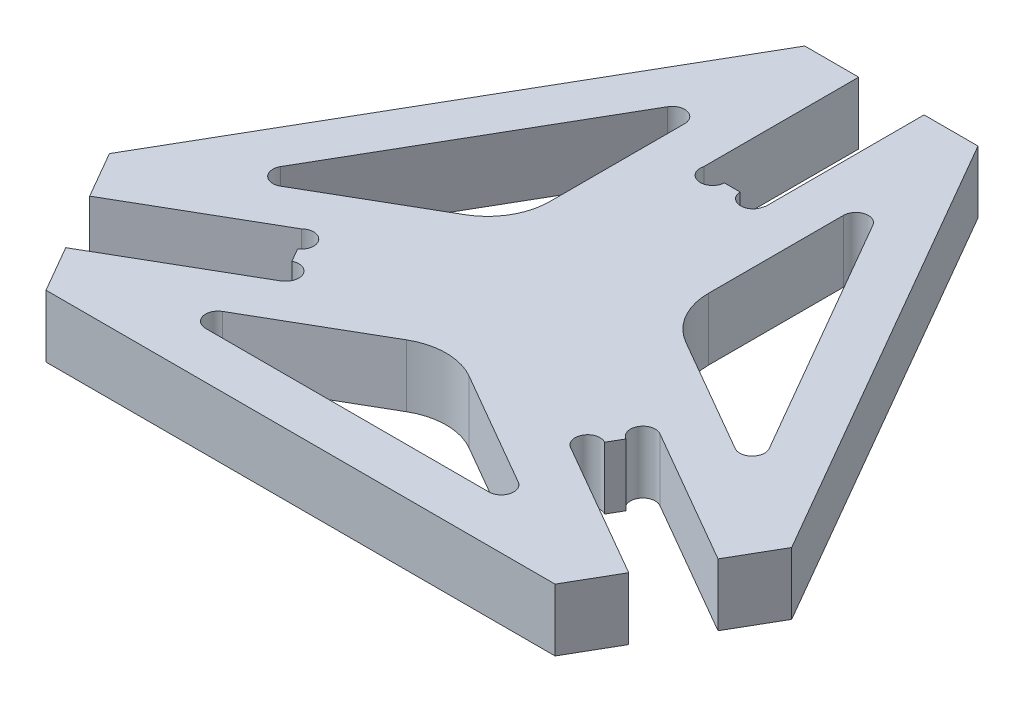
from build123d import *

# Parameters (mm, degrees)
EXTRUDE_1_DEPTH          = 1
CUT_EXTRUDE_1_DEPTH      = 5
SKETCH_4_R               = 0.4
CUT_EXTRUDE_2_DEPTH      = 5
PATTERN_CIRCULAR_3_COUNT = 3
FILLET_1_R               = 0.4
FILLET_2_R               = 2


with BuildPart() as part:
    # 草图1 → 凸台-拉伸1 (new, symmetric)
    with BuildSketch(Plane(origin=(0, 0, 0), x_dir=(1, 0, 0), z_dir=(0, 1, 0))):
        Polygon((9.041729559, -19.298041681), (-9.041729559, -19.298041681), (-8.175704156, -20.798041681), (8.175704156, -20.798041681), align=None)
        Polygon((2.782050808, -1.818653348), (1.05, -1.818653348), (10.091729559, -17.479388333), (10.957754963, -15.979388333), align=None)
        Polygon((-10.091729559, -17.479388333), (-1.05, -1.818653348), (-2.782050808, -1.818653348), (-10.957754963, -15.979388333), align=None)
        Polygon((-1.05, -6.918653348), (-1.05, -1.818653348), (-10.091729559, -17.479388333), (-5.675, -14.929388333), (-4.625, -16.748041681), (-9.041729559, -19.298041681), (9.041729559, -19.298041681), (4.625, -16.748041681), (5.675, -14.929388333), (10.091729559, -17.479388333), (1.05, -1.818653348), (1.05, -6.918653348), align=None)
    extrude(amount=EXTRUDE_1_DEPTH, both=True)

    # 草图2 → 切除-拉伸1 (cut, symmetric)
    with BuildSketch(Plane(origin=(0, 1, 0), x_dir=(1, 0, 0), z_dir=(0, 1, 0))):
        Polygon((8.591729559, -14.881312122), (2.55, -4.416729559), (2.55, -11.393117934), align=None)
        Polygon((6.041729559, -19.298041681), (0, -15.809847493), (-6.041729559, -19.298041681), align=None)
        Polygon((-2.55, -11.393117934), (-2.55, -4.416729559), (-8.591729559, -14.881312122), align=None)
    extrude(amount=CUT_EXTRUDE_1_DEPTH, both=True, mode=Mode.SUBTRACT)

    # 草图4 → 切除-拉伸2 (cut, symmetric)
    with BuildSketch(Plane(origin=(0, 1, 0), x_dir=(1, 0, 0), z_dir=(0, 1, 0))):
        with Locations((5.475, -15.275798494)):
            Circle(SKETCH_4_R)
        with Locations((4.825, -16.401631519)):
            Circle(SKETCH_4_R)
    cut_extrude_2 = extrude(amount=CUT_EXTRUDE_2_DEPTH, both=True, mode=Mode.SUBTRACT)

    # 阵列(圆周)3: 切除-拉伸2 ×3 about axis
    pattern_circular_3_axis = Axis((-0.013172797, 0, 12.857755803), (0, 1, 0))
    for i in range(1, PATTERN_CIRCULAR_3_COUNT):
        add(cut_extrude_2.rotate(pattern_circular_3_axis, i * 360 / PATTERN_CIRCULAR_3_COUNT), mode=Mode.SUBTRACT)

    # 圆角1
    fillet_1_edges = [part.edges().sort_by_distance(p)[0] for p in [
        (-2.55, 0, 4.416729559),
        (-8.591729559, 0, 14.881312122),
        (-6.041729559, 0, 19.298041681),
        (6.041729559, 0, 19.298041681),
        (8.591729559, 0, 14.881312122),
        (2.55, 0, 4.416729559),
    ]]
    fillet(fillet_1_edges, radius=FILLET_1_R)

    # 圆角2
    fillet_2_edges = [part.edges().sort_by_distance(p)[0] for p in [
        (-2.55, 0, 11.393117934),
        (0, 0, 15.809847493),
        (2.55, 0, 11.393117934),
    ]]
    fillet(fillet_2_edges, radius=FILLET_2_R)


solid = part.part
